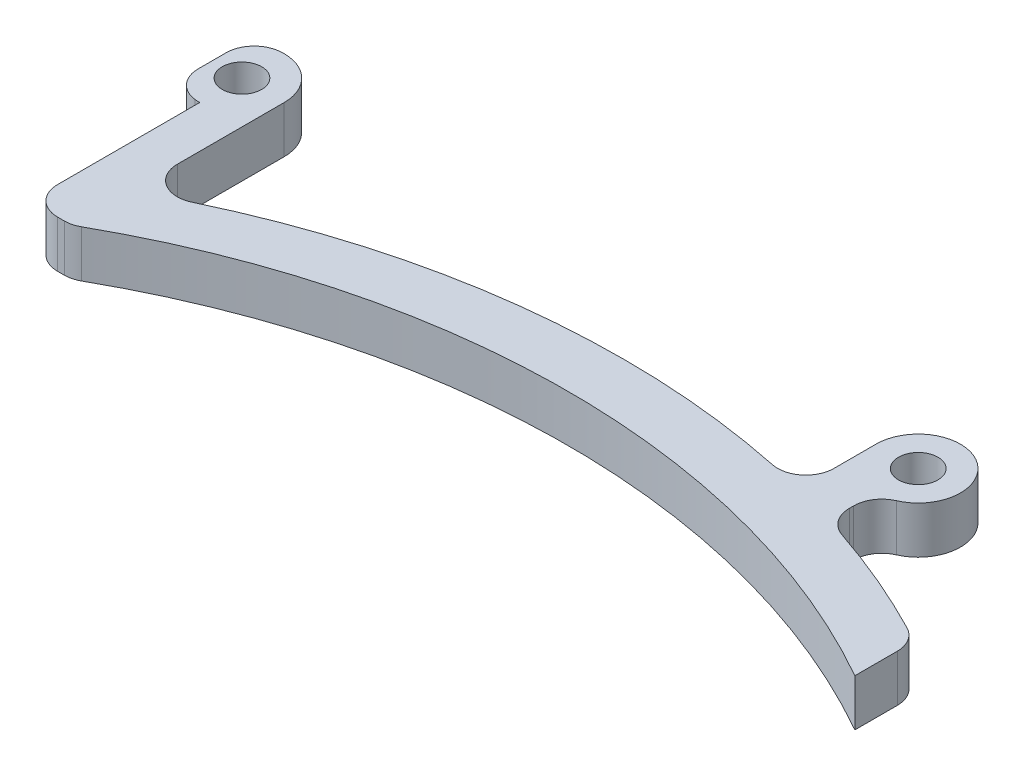
from build123d import *

# Parameters (mm, degrees)
SKETCH1_R           = 2.1
BOSS_EXTRUDE1_DEPTH = 5
FILLET1_R           = 3


with BuildPart() as part:
    # Sketch1 → Boss-Extrude1 (new body)
    with BuildSketch(Plane(origin=(0, 0, 0), x_dir=(1, 0, 0), z_dir=(0, 1, 0))):
        with BuildLine():
            Line((72, -9.503100502), (72, -4.5))
            ThreePointArc((72, -4.5), (75.181980515, 3.181980515), (67.5, 0))
            Line((67.5, 0), (67.5, -8.236120217))
            ThreePointArc((67.5, -8.236120217), (35.23528273, -6.295142783), (4.5, -16.301229399))
            Line((4.5, -16.301229399), (4.5, 0))
            ThreePointArc((4.5, 0), (1.722075446, 4.157457896), (-3.181980515, 3.181980515))
            Line((-3.181980515, 3.181980515), (-3.181980515, -3.181980515))
            ThreePointArc((-3.181980515, -3.181980515), (-1.722075446, -4.157457896), (0, -4.5))
            Line((0, -4.5), (0, -22.629109119))
            Line((0, -22.629109119), (4.5, -22.629109119))
            ThreePointArc((4.5, -22.629109119), (46.093164739, -11.519039327), (87.727526709, -22.473714454))
            Line((87.727526709, -22.473714454), (87.727526709, -16.152250539))
            ThreePointArc((87.727526709, -16.152250539), (80.027772069, -12.439738504), (72, -9.503100502))
        make_face()
        with Locations(Location((0, 0, 0), (0, 0, 270))):
            Circle(SKETCH1_R, mode=Mode.SUBTRACT)
        with Locations(Location((72, 0, 0), (0, 0, 270))):
            Circle(SKETCH1_R, mode=Mode.SUBTRACT)
    extrude(amount=BOSS_EXTRUDE1_DEPTH)

    # Fillet1
    fillet1_edges = [part.edges().sort_by_distance(p)[0] for p in [
        (-3.181980515, 2.5, 3.181980515),
        (-3.181980515, 2.5, -3.181980515),
        (4.5, 2.5, 16.301229399),
        (67.5, 2.5, 8.236120217),
        (72, 2.5, 4.5),
        (72, 2.5, 9.503100502),
        (87.727526709, 2.5, 16.152250539),
        (4.5, 2.5, 22.629109119),
        (0, 2.5, 22.629109119),
    ]]
    fillet(fillet1_edges, radius=FILLET1_R)


solid = part.part
